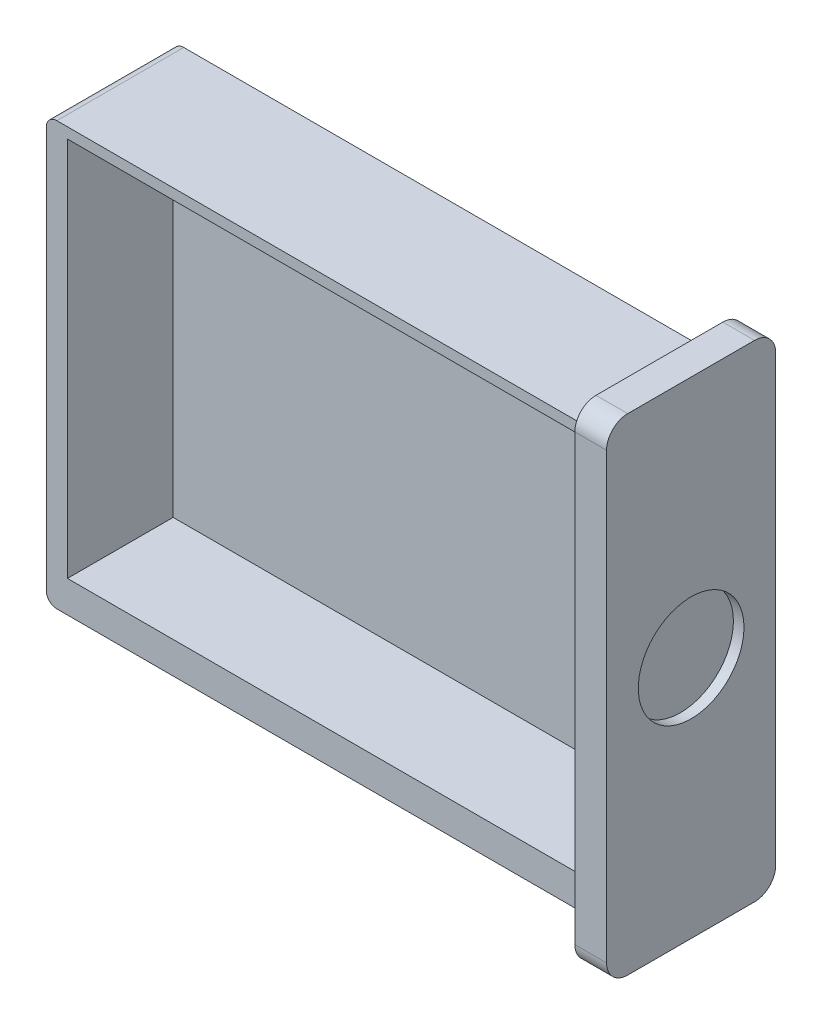
from build123d import *

# Parameters (mm, degrees)
SKETCH1_W           = 52
SKETCH1_H           = 40
BOSS_EXTRUDE1_DEPTH = 6
FILLET1_R           = 1
SKETCH2_W           = 48
SKETCH2_H           = 36
CUT_EXTRUDE1_DEPTH  = 10
SKETCH3_W           = 16
SKETCH3_H           = 46
BOSS_EXTRUDE2_DEPTH = 3
FILLET2_R           = 2
SKETCH4_R           = 5
CUT_EXTRUDE2_DEPTH  = 1
SKETCH5_W           = 3
SKETCH5_H           = 6
BOSS_EXTRUDE3_DEPTH = 1


with BuildPart() as part:
    # Sketch1 → Boss-Extrude1 (new, symmetric)
    with BuildSketch(Plane.XY):
        Rectangle(SKETCH1_W, SKETCH1_H)
    extrude(amount=BOSS_EXTRUDE1_DEPTH, both=True)

    # Fillet1
    fillet1_edges = [part.edges().sort_by_distance(p)[0] for p in [
        (-26, 20, 0),
        (26, 20, 0),
        (26, -20, 0),
        (-26, -20, 0),
    ]]
    fillet(fillet1_edges, radius=FILLET1_R)

    # Sketch2 → Cut-Extrude1 (cut)
    with BuildSketch(Plane.XY.offset(6)):
        with Locations((0, 1)):
            Rectangle(SKETCH2_W, SKETCH2_H)
    extrude(amount=-CUT_EXTRUDE1_DEPTH, mode=Mode.SUBTRACT)

    # Sketch3 → Boss-Extrude2 (add)
    with BuildSketch(Plane(origin=(26.00000007, 0, 0), x_dir=(0, 0, -1), z_dir=(1, 0, 0))):
        Rectangle(SKETCH3_W, SKETCH3_H)
    extrude(amount=BOSS_EXTRUDE2_DEPTH)

    # Fillet2
    fillet2_edges = [part.edges().sort_by_distance(p)[0] for p in [
        (27.50000007, 23, 8),
        (27.50000007, -23, 8),
        (27.50000007, -23, -8),
        (27.50000007, 23, -8),
    ]]
    fillet(fillet2_edges, radius=FILLET2_R)

    # Sketch4 → Cut-Extrude2 (cut)
    with BuildSketch(Plane(origin=(29.00000007, 0, 0), x_dir=(0, 0, -1), z_dir=(1, 0, 0))):
        Circle(SKETCH4_R)
    extrude(amount=-CUT_EXTRUDE2_DEPTH, mode=Mode.SUBTRACT)

    # Sketch5 → Boss-Extrude3 (add)
    with BuildSketch(Plane.ZY.offset(26)):
        with Locations((0, 8)):
            Rectangle(SKETCH5_W, SKETCH5_H)
        with Locations((0, -8)):
            Rectangle(SKETCH5_W, SKETCH5_H)
    extrude(amount=BOSS_EXTRUDE3_DEPTH)


solid = part.part
